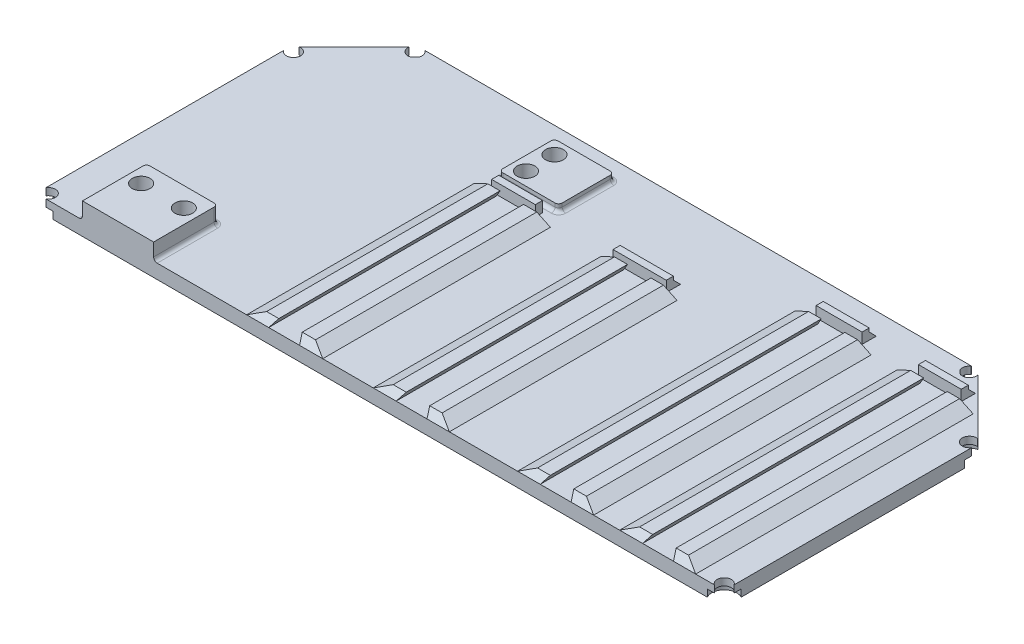
from build123d import *
from build123d.topology import SkipClean

# Parameters (mm, degrees)
BOSS_EXTRUDE1_DEPTH  = 4
SKETCH14_R           = 2
CUT_EXTRUDE6_DEPTH   = 15
SKETCH15_R           = 3.5
CUT_EXTRUDE8_DEPTH   = 2
FILLET1_R            = 5
CUT_EXTRUDE9_DEPTH   = 10
SKETCH19_W           = 20
SKETCH19_H           = 18
BOSS_EXTRUDE3_DEPTH  = 10
FILLET2_R            = 1
SKETCH20_R           = 2.5
CUT_EXTRUDE11_DEPTH  = 7
SKETCH22_W           = 12.771739203
SKETCH22_H           = 9.483989937
BOSS_EXTRUDE4_DEPTH  = 7
SKETCH23_W           = 89.809130607
SKETCH23_H           = 26.593384299
CUT_EXTRUDE12_DEPTH  = 89.4
BOSS_EXTRUDE5_DEPTH  = 78
CHAMFER1_SIZE        = 1.8
SKETCH27_W           = 20
SKETCH27_H           = 18
BOSS_EXTRUDE7_DEPTH  = 4.65
SKETCH29_R           = 2.5
CUT_EXTRUDE13_DEPTH  = 7
BOSS_EXTRUDE9_DEPTH  = 2
BOSS_EXTRUDE10_DEPTH = 2
CUT_EXTRUDE14_START  = 2
SKETCH34_R           = 3.5
CUT_EXTRUDE14_DEPTH  = 2
CUT_EXTRUDE15_DEPTH  = 14
SKETCH26_W           = 12.281321475
SKETCH26_H           = 2
SKETCH26_W_2         = 14.964279685
SKETCH26_W_3         = 12.914766221
SKETCH26_W_4         = 12.03135527
BOSS_EXTRUDE6_DEPTH  = 3
SKETCH31_W           = 16.690236125
SKETCH31_H           = 15.521919596
SKETCH31_R           = 2.5
BOSS_EXTRUDE8_DEPTH  = 2
FILLET3_R            = 1
CUT_EXTRUDE16_START  = -3
SKETCH37_R           = 2.5
CUT_EXTRUDE16_DEPTH  = 3
CHAMFER2_SIZE        = 2


with BuildPart() as part:
    # Sketch1 → Boss-Extrude1 (new body)
    with BuildSketch(Plane(origin=(0, 0, 0), x_dir=(1, 0, 0), z_dir=(0, 1, 0))):
        Polygon((-68, 48), (-88, 28), (-88, -48), (88, -48), (88, 28), (68, 48), align=None)
    extrude(amount=BOSS_EXTRUDE1_DEPTH)

    # Sketch14 → Cut-Extrude6 (cut)
    with BuildSketch(Plane(origin=(0, 4, 0), x_dir=(1, 0, 0), z_dir=(0, 1, 0))):
        with Locations(Location((-65.928932188, 43, 0), (0, 0, 270))):
            Circle(SKETCH14_R)
        with Locations(Location((-83, 25.928932188, 0), (0, 0, 270))):
            Circle(SKETCH14_R)
        with Locations(Location((-83, -43, 0), (0, 0, 270))):
            Circle(SKETCH14_R)
        with Locations(Location((65.928932188, 43, 0), (0, 0, 270))):
            Circle(SKETCH14_R)
        with Locations(Location((83, 25.928932188, 0), (0, 0, 270))):
            Circle(SKETCH14_R)
        with Locations(Location((83, -43, 0), (0, 0, 270))):
            Circle(SKETCH14_R)
    extrude(amount=-CUT_EXTRUDE6_DEPTH, mode=Mode.SUBTRACT)

    # Sketch15 → Cut-Extrude8 (cut)
    with BuildSketch(Plane.XZ):
        with Locations(Location((-83, 43, 0), (0, 0, 270))):
            Circle(SKETCH15_R)
        with Locations(Location((-83, -25.928932188, 0), (0, 0, 270))):
            Circle(SKETCH15_R)
        with Locations(Location((-65.928932188, -43, 0), (0, 0, 270))):
            Circle(SKETCH15_R)
        with Locations(Location((65.928932188, -43, 0), (0, 0, 90))):
            Circle(SKETCH15_R)
        with Locations(Location((83, -25.928932188, 0), (0, 0, 90))):
            Circle(SKETCH15_R)
        with Locations(Location((83, 43, 0), (0, 0, 90))):
            Circle(SKETCH15_R)
    extrude(amount=-CUT_EXTRUDE8_DEPTH, mode=Mode.SUBTRACT)

    # Fillet1
    fillet1_edges = [part.edges().sort_by_distance(p)[0] for p in [
        (88, 2, 48),
        (-88, 2, 48),
        (-88, 2, -28),
        (-68, 2, -48),
        (68, 2, -48),
        (88, 2, -28),
    ]]
    fillet(fillet1_edges, radius=FILLET1_R)

    # Sketch10 → Cut-Extrude9 (cut)
    with BuildSketch(Plane(origin=(0, 4, 0), x_dir=(1, 0, 0), z_dir=(0, 1, 0))):
        Polygon((88, 28), (68, 48), (-68, 48), (-88, 28), (-88, -48), (88, -48), align=None)
        with BuildLine():
            Line((82.015037689, -44.7), (-82.015037689, -44.7))
            ThreePointArc((-82.015037689, -44.7), (-82.878679656, -42.878679656), (-84.7, -42.015037689))
            Line((-84.7, -42.015037689), (-84.7, 24.77998732))
            ThreePointArc((-84.7, 24.77998732), (-83.152240935, 25.991992448), (-83.38965482, 27.943440424))
            Line((-83.38965482, 27.943440424), (-67.943440424, 43.38965482))
            ThreePointArc((-67.943440424, 43.38965482), (-65.991992448, 43.152240935), (-64.77998732, 44.7))
            Line((-64.77998732, 44.7), (64.77998732, 44.7))
            ThreePointArc((64.77998732, 44.7), (65.991992448, 43.152240935), (67.943440424, 43.38965482))
            Line((67.943440424, 43.38965482), (83.38965482, 27.943440424))
            ThreePointArc((83.38965482, 27.943440424), (83.152240935, 25.991992448), (84.7, 24.77998732))
            Line((84.7, 24.77998732), (84.7, -42.015037689))
            ThreePointArc((84.7, -42.015037689), (82.878679656, -42.878679656), (82.015037689, -44.7))
        make_face(mode=Mode.SUBTRACT)
    extrude(amount=-CUT_EXTRUDE9_DEPTH, mode=Mode.SUBTRACT)

    # Sketch19 → Boss-Extrude3 (add)
    with BuildSketch(Plane(origin=(0, 4, 0), x_dir=(1, 0, 0), z_dir=(0, 1, 0))):
        with Locations((-66.7, -33.7)):
            Rectangle(SKETCH19_W, SKETCH19_H)
    extrude(amount=BOSS_EXTRUDE3_DEPTH)

    # Fillet2
    fillet2_edges = [part.edges().sort_by_distance(p)[0] for p in [
        (-56.7, 4, 33.7),
        (-56.7, 9, 42.7),
        (-66.7, 4, 24.7),
        (-56.7, 9, 24.7),
        (-76.7, 4, 33.7),
        (-76.7, 9, 24.7),
        (-66.7, 4, 42.7),
        (-76.7, 9, 42.7),
    ]]
    fillet(fillet2_edges, radius=FILLET2_R)

    # Sketch20 → Cut-Extrude11 (cut)
    with BuildSketch(Plane(origin=(0, 14, 0), x_dir=(1, 0, 0), z_dir=(0, 1, 0))):
        with Locations(Location((-72.7, -30.7, 0), (0, 0, 270))):
            Circle(SKETCH20_R)
        with Locations(Location((-60.7, -30.7, 0), (0, 0, 270))):
            Circle(SKETCH20_R)
    extrude(amount=-CUT_EXTRUDE11_DEPTH, mode=Mode.SUBTRACT)

    # Sketch22 → Boss-Extrude4 (add)
    with BuildSketch(Plane(origin=(0, 4, 0), x_dir=(1, 0, 0), z_dir=(0, 1, 0))):
        with Locations((-63.26521836, 26.866876224)):
            Rectangle(SKETCH22_W, SKETCH22_H)
    extrude(amount=BOSS_EXTRUDE4_DEPTH)

    # Sketch23 → Cut-Extrude12 (cut)
    with BuildSketch(Plane(origin=(0, 0, -44.7), x_dir=(-1, 0, 0), z_dir=(0, 0, -1))):
        with Locations((51.904565304, 13.29669215)):
            Rectangle(SKETCH23_W, SKETCH23_H)
    extrude(amount=-CUT_EXTRUDE12_DEPTH, mode=Mode.SUBTRACT)

    # Mirror1: part across plane


with BuildPart() as part_1:
    add(part.part)
    add(part.part.mirror(Plane(origin=(-7, 0, 138.36369643), x_dir=(0, 0, 1), z_dir=(1, 0, 0))))

    # Sketch25 → Boss-Extrude5 (add)
    with BuildSketch(Plane.XY.offset(44.7)):
        Polygon((-44.552736061, 4), (-38.351812719, 4), (-37.312582234, 5.8), (-40.736438675, 5.8), align=None)
        Polygon((-29.674684589, 4), (-30.713915074, 5.8), (-26.983219906, 5.8), (-23.16692252, 4), align=None)
        Polygon((-1.486084926, 5.8), (-2.525315411, 4), (-8.959940042, 4), (-5.143642656, 5.8), align=None)
        Polygon((6.151812719, 4), (5.112582234, 5.8), (8.609576113, 5.8), (12.425873499, 4), align=None)
        Polygon((37.972195357, 4), (39.011425841, 5.8), (35.418341792, 5.8), (31.602044406, 4), align=None)
        Polygon((45.610093002, 5.8), (46.649323486, 4), (52.987857947, 4), (49.171560561, 5.8), align=None)
        Polygon((66.750676514, 4), (67.789906998, 5.8), (64.109946158, 5.8), (60.293648771, 4), align=None)
        Polygon((74.388574159, 5.8), (75.427804643, 4), (81.679462313, 4), (77.863164927, 5.8), align=None)
    extrude(amount=-BOSS_EXTRUDE5_DEPTH)

    # Chamfer1
    chamfer1_edges = [part_1.edges().sort_by_distance(p)[0] for p in [
        (76.125869543, 5.8, 44.7),
        (65.949926578, 5.8, 44.7),
        (47.390826781, 5.8, 44.7),
        (37.214883817, 5.8, 44.7),
        (6.861079173, 5.8, 44.7),
        (-3.314863791, 5.8, 44.7),
        (-28.84856749, 5.8, 44.7),
        (-39.024510454, 5.8, 44.7),
    ]]
    chamfer(chamfer1_edges, length=CHAMFER1_SIZE)

    # Sketch27 → Boss-Extrude7 (add)
    with BuildSketch(Plane(origin=(0, 4, 0), x_dir=(1, 0, 0), z_dir=(0, 1, 0))):
        with Locations((-80.7, -35.7)):
            Rectangle(SKETCH27_W, SKETCH27_H)
    extrude(amount=BOSS_EXTRUDE7_DEPTH)

    # Sketch29 → Cut-Extrude13 (cut)
    with BuildSketch(Plane(origin=(0, 8.65, 0), x_dir=(1, 0, 0), z_dir=(0, 1, 0))):
        with Locations(Location((-86.705148319, -32.2, 0), (0, 0, 270))):
            Circle(SKETCH29_R)
        with Locations(Location((-74.705148319, -32.2, 0), (0, 0, 270))):
            Circle(SKETCH29_R)
    extrude(amount=-CUT_EXTRUDE13_DEPTH, mode=Mode.SUBTRACT)

    # Sketch32 → Boss-Extrude9 (add)
    with BuildSketch(Plane(origin=(0, 4, 0), x_dir=(1, 0, 0), z_dir=(0, 1, 0))):
        with BuildLine():
            Line((81.479462313, -44.7), (86.946434625, -44.7))
            ThreePointArc((86.946434625, -44.7), (86.585786438, -41.585786438), (89.7, -41.946434625))
            Line((89.7, -41.946434625), (89.7, 24.77998732))
            ThreePointArc((89.7, 24.77998732), (89.671763586, 24.784477954), (89.643594253, 24.789371776))
            ThreePointArc((89.643594253, 24.789371776), (86.152240935, 25.163565323), (88.356405747, 27.896919725))
            ThreePointArc((88.356405747, 27.896919725), (88.372864019, 27.920298906), (88.38965482, 27.943440424))
            Line((88.38965482, 27.943440424), (72.943440424, 43.38965482))
            ThreePointArc((72.943440424, 43.38965482), (72.920298906, 43.372864019), (72.896919725, 43.356405747))
            ThreePointArc((72.896919725, 43.356405747), (70.163565323, 41.152240935), (69.789371776, 44.643594253))
            ThreePointArc((69.789371776, 44.643594253), (69.784477954, 44.671763586), (69.77998732, 44.7))
            Line((69.77998732, 44.7), (-83.77998732, 44.7))
            ThreePointArc((-83.77998732, 44.7), (-83.784477954, 44.671763586), (-83.789371776, 44.643594253))
            ThreePointArc((-83.789371776, 44.643594253), (-84.163565323, 41.152240935), (-86.896919725, 43.356405747))
            ThreePointArc((-86.896919725, 43.356405747), (-86.920298906, 43.372864019), (-86.943440424, 43.38965482))
            Line((-86.943440424, 43.38965482), (-102.38965482, 27.943440424))
            ThreePointArc((-102.38965482, 27.943440424), (-102.372864019, 27.920298906), (-102.356405747, 27.896919725))
            ThreePointArc((-102.356405747, 27.896919725), (-100.152240935, 25.163565323), (-103.643594253, 24.789371776))
            ThreePointArc((-103.643594253, 24.789371776), (-103.671763586, 24.784477954), (-103.7, 24.77998732))
            Line((-103.7, 24.77998732), (-103.7, -41.946434625))
            ThreePointArc((-103.7, -41.946434625), (-100.585786438, -41.585786438), (-100.946434625, -44.7))
            Line((-100.946434625, -44.7), (81.479462313, -44.7))
        make_face()
    extrude(amount=-BOSS_EXTRUDE9_DEPTH)

    # Sketch33 → Boss-Extrude10 (add)
    with BuildSketch(Plane.XZ):
        with BuildLine():
            Line((84.940588292, 44.7), (-98.940588292, 44.7))
            ThreePointArc((-98.940588292, 44.7), (-99.525126266, 40.525126266), (-103.7, 39.940588292))
            Line((-103.7, 39.940588292), (-103.7, -22.86952048))
            ThreePointArc((-103.7, -22.86952048), (-98.766421636, -24.589540175), (-101.038750763, -29.294344481))
            Line((-101.038750763, -29.294344481), (-88.294344481, -42.038750763))
            ThreePointArc((-88.294344481, -42.038750763), (-83.589540175, -39.766421636), (-81.86952048, -44.7))
            Line((-81.86952048, -44.7), (67.86952048, -44.7))
            ThreePointArc((67.86952048, -44.7), (69.589540175, -39.766421636), (74.294344481, -42.038750763))
            Line((74.294344481, -42.038750763), (87.038750763, -29.294344481))
            ThreePointArc((87.038750763, -29.294344481), (84.766421636, -24.589540175), (89.7, -22.86952048))
            Line((89.7, -22.86952048), (89.7, 39.940588292))
            ThreePointArc((89.7, 39.940588292), (85.525126266, 40.525126266), (84.940588292, 44.7))
        make_face()
    extrude(amount=-BOSS_EXTRUDE10_DEPTH)

    # Sketch34 → Cut-Extrude14 (cut)
    with SkipClean():  # the faces are left unmerged after this step: merging them gives an invalid solid
        with BuildSketch(Plane.XZ.offset(-2).offset(CUT_EXTRUDE14_START)):
            with Locations((-84.928932188, -43)):
                Circle(SKETCH34_R)
            with Locations((70.928932188, -43)):
                Circle(SKETCH34_R)
        extrude(amount=-CUT_EXTRUDE14_DEPTH, mode=Mode.SUBTRACT)

    # Sketch36 → Cut-Extrude15 (cut)
    with SkipClean():  # the faces are left unmerged after this step: merging them gives an invalid solid
        with BuildSketch(Plane(origin=(0, 0, -33.3), x_dir=(-1, 0, 0), z_dir=(0, 0, -1))):
            Polygon((37.312582234, 5.8), (38.351812719, 4), (44.552736061, 4), (40.736438675, 5.8), align=None)
            Polygon((23.16692252, 4), (29.674684589, 4), (30.713915074, 5.8), (26.983219906, 5.8), align=None)
            Polygon((2.525315411, 4), (8.959940042, 4), (5.143642656, 5.8), (1.486084926, 5.8), align=None)
            Polygon((-12.425873499, 4), (-6.151812719, 4), (-5.112582234, 5.8), (-8.609576113, 5.8), align=None)
        extrude(amount=-CUT_EXTRUDE15_DEPTH, mode=Mode.SUBTRACT)

    # Sketch26 → Boss-Extrude6 (add)
    with SkipClean():  # the faces are left unmerged after this step: merging them gives an invalid solid
        with BuildSketch(Plane(origin=(0, 4, 0), x_dir=(1, 0, 0), z_dir=(0, 1, 0))):
            with Locations((-33.94228357, 20.7)):
                Rectangle(SKETCH26_W, SKETCH26_H)
            with Locations((1.526601791, 20.7)):
                Rectangle(SKETCH26_W_2, SKETCH26_H)
            with Locations((42.686432004, 35.6)):
                Rectangle(SKETCH26_W_3, SKETCH26_H)
            with Locations((70.990849415, 35.6)):
                Rectangle(SKETCH26_W_4, SKETCH26_H)
        extrude(amount=BOSS_EXTRUDE6_DEPTH)

    # Sketch31 → Boss-Extrude8 (add)
    with SkipClean():  # the faces are left unmerged after this step: merging them gives an invalid solid
        with BuildSketch(Plane(origin=(0, 4, 0), x_dir=(1, 0, 0), z_dir=(0, 1, 0))):
            with Locations((-33.775839682, 31.630255934)):
                Rectangle(SKETCH31_W, SKETCH31_H)
            with Locations(Location((-38.266176731, 35.540253239, 0), (0, 0, 270))):
                Circle(SKETCH31_R, mode=Mode.SUBTRACT)
            with Locations(Location((-38.266176731, 27.540252604, 0), (0, 0, 270))):
                Circle(SKETCH31_R, mode=Mode.SUBTRACT)
        extrude(amount=BOSS_EXTRUDE8_DEPTH)

    # Fillet3
    fillet3_edges = [part_1.edges().sort_by_distance(p)[0] for p in [
        (-70.7, 4, 35.7),
        (-80.7, 4, 26.7),
        (-70.7, 6.325, 26.7),
        (-90.7, 4, 35.7),
        (-90.7, 6.325, 26.7),
        (-42.120957744, 4, -28.584648068),
        (-42.120957744, 5, -39.391215732),
        (-34.013248654, 4, -23.869296136),
        (-42.120957744, 5, -23.869296136),
        (-25.430721619, 4, -28.584648068),
        (-25.430721619, 5, -23.869296136),
        (-33.775839682, 4, -39.391215732),
        (-25.430721619, 5, -39.391215732),
    ]]
    fillet(fillet3_edges, radius=FILLET3_R)

    # Sketch37 → Cut-Extrude16 (cut)
    with SkipClean():  # the faces are left unmerged after this step: merging them gives an invalid solid
        with BuildSketch(Plane(origin=(0, 4, 0), x_dir=(1, 0, 0), z_dir=(0, 1, 0)).offset(CUT_EXTRUDE16_START)):
            with Locations(Location((-38.266176731, 27.540252604, 0), (0, 0, 270))):
                Circle(SKETCH37_R)
            with Locations(Location((-38.266176731, 35.540253239, 0), (0, 0, 270))):
                Circle(SKETCH37_R)
        extrude(amount=CUT_EXTRUDE16_DEPTH, mode=Mode.SUBTRACT)

    # Chamfer2
    chamfer2_edges = [part_1.edges().sort_by_distance(p)[0] for p in [
        (1.813248654, 4, -21.7),
        (42.686432003, 4, -36.6),
        (70.990849415, 4, -36.6),
    ]]
    chamfer(chamfer2_edges, length=CHAMFER2_SIZE)


solid = part_1.part
